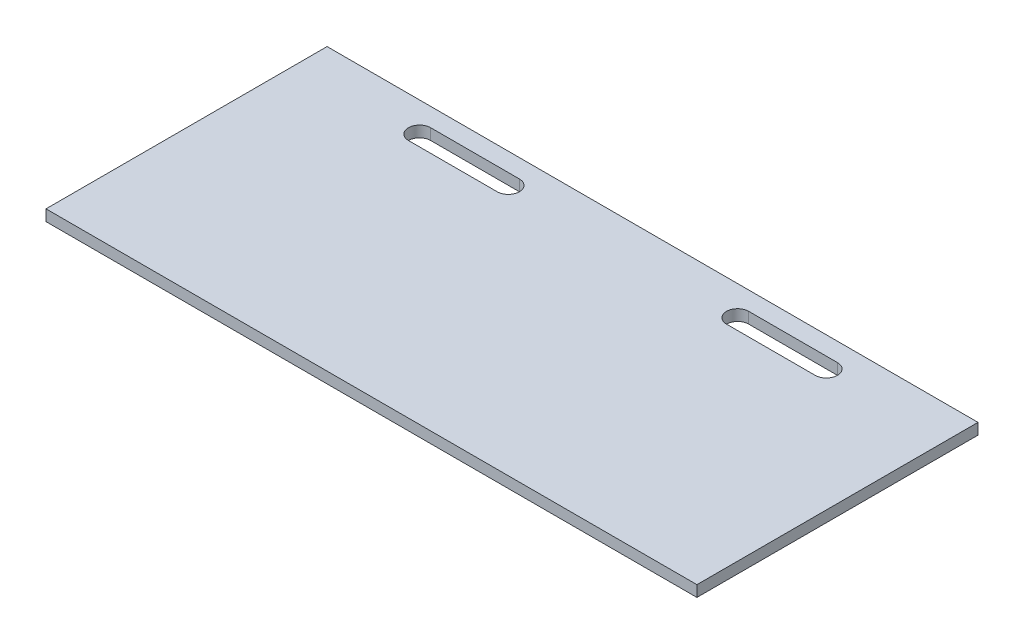
from build123d import *

# Parameters (mm, degrees)
SKETCH1_W               = 1117.6
SKETCH1_H               = 482.6
BOSS_EXTRUDE1_DEPTH     = 9.525
CUT_EXTRUDE1_DEPTH      = 609.971290374
CUT_EXTRUDE1_DEPTH_BACK = 609.971290374


with BuildPart() as part:
    # Sketch1 → Boss-Extrude1 (new, symmetric)
    with BuildSketch(Plane(origin=(0, 0, 0), x_dir=(1, 0, 0), z_dir=(0, 1, 0))):
        Rectangle(SKETCH1_W, SKETCH1_H)
    extrude(amount=BOSS_EXTRUDE1_DEPTH, both=True)

    # Sketch2 → Cut-Extrude1 (cut, two sides: drawn at the far end of the back side and taken through both)
    with BuildSketch(Plane.XZ.offset(9.525).offset(-CUT_EXTRUDE1_DEPTH_BACK)):
        with BuildLine():
            Line((-349.25, -171.45), (-196.85, -171.45))
            ThreePointArc((-196.85, -171.45), (-177.8, -190.5), (-196.85, -209.55))
            Line((-196.85, -209.55), (-349.25, -209.55))
            ThreePointArc((-349.25, -209.55), (-368.3, -190.5), (-349.25, -171.45))
        make_face()
        with BuildLine():
            Line((196.85, -171.45), (349.25, -171.45))
            ThreePointArc((349.25, -171.45), (368.3, -190.5), (349.25, -209.55))
            Line((349.25, -209.55), (196.85, -209.55))
            ThreePointArc((196.85, -209.55), (177.8, -190.5), (196.85, -171.45))
        make_face()
    extrude(amount=CUT_EXTRUDE1_DEPTH + CUT_EXTRUDE1_DEPTH_BACK, mode=Mode.SUBTRACT)


solid = part.part
